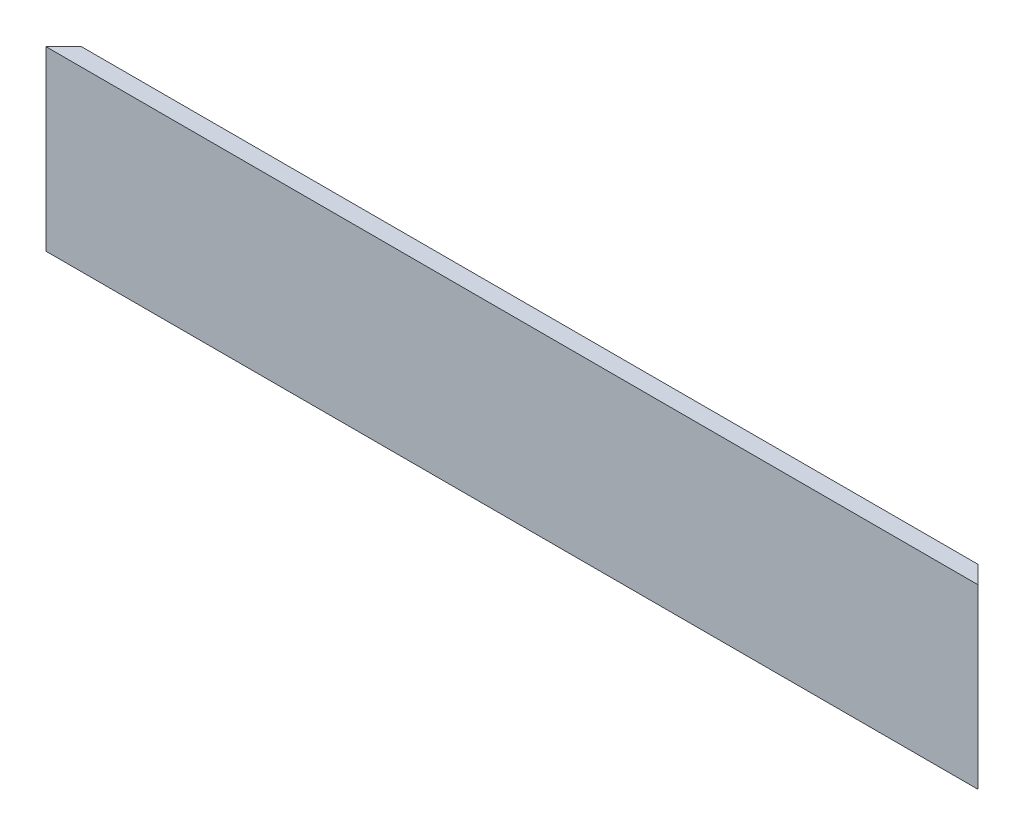
from build123d import *

# Parameters (mm, degrees)
CROQUIS1_W              = 526
CROQUIS1_H              = 10
SALIENTE_EXTRUIR1_DEPTH = 100
CORTAR_EXTRUIR1_DEPTH   = 100
CROQUIS3_W              = 526
CROQUIS3_H              = 97.5
CORTAR_EXTRUIR2_DEPTH   = 9.25


with BuildPart() as part:
    # Croquis1 → Saliente-Extruir1 (new body)
    with BuildSketch(Plane(origin=(0, 0, 0), x_dir=(1, 0, 0), z_dir=(0, 1, 0))):
        Rectangle(CROQUIS1_W, CROQUIS1_H)
    extrude(amount=SALIENTE_EXTRUIR1_DEPTH)

    # Croquis2 → Cortar-Extruir1 (cut)
    with BuildSketch(Plane(origin=(0, 100, 0), x_dir=(1, 0, 0), z_dir=(0, 1, 0))):
        Polygon((-263, -5), (-253, 5), (-263, 5), align=None)
        Polygon((253, 5), (263, 5), (263, -5), align=None)
    extrude(amount=-CORTAR_EXTRUIR1_DEPTH, mode=Mode.SUBTRACT)

    # Croquis3 → Cortar-Extruir2 (cut)
    with BuildSketch(Plane(origin=(0, 0, -5), x_dir=(-1, 0, 0), z_dir=(0, 0, -1))):
        with Locations((0, 50)):
            Rectangle(CROQUIS3_W, CROQUIS3_H)
    extrude(amount=-CORTAR_EXTRUIR2_DEPTH, mode=Mode.SUBTRACT)


solid = part.part
